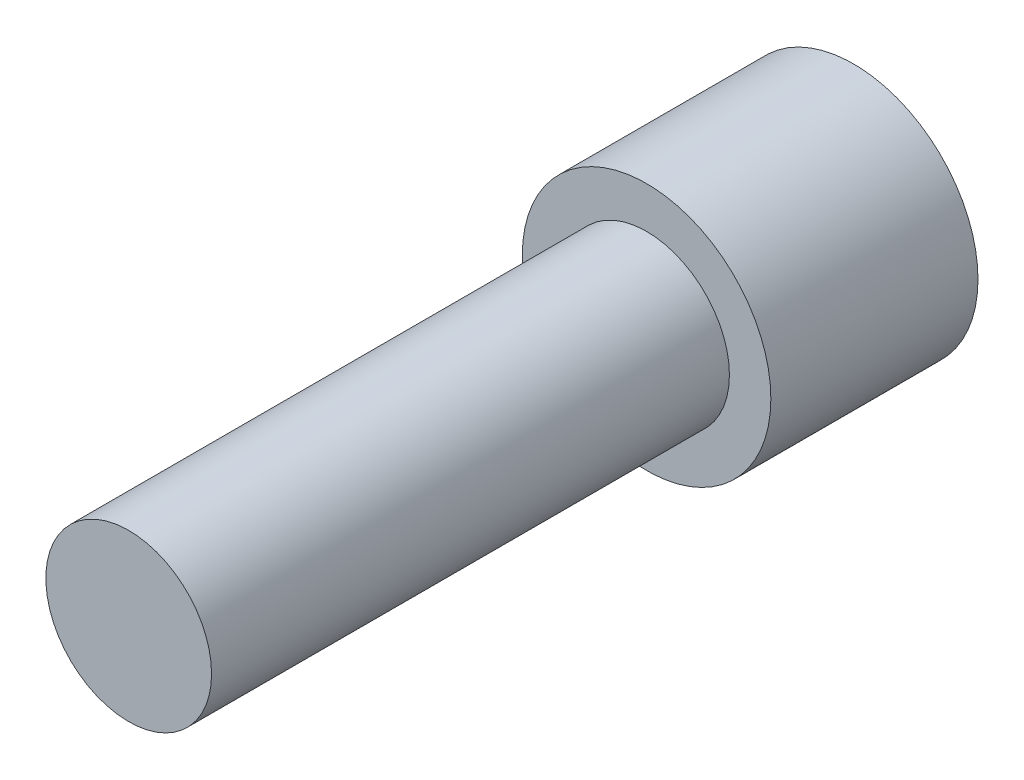
from build123d import *

# Parameters (mm, degrees)
SKETCH1_R           = 6
BOSS_EXTRUDE1_DEPTH = 10
SKETCH3_R           = 4
BOSS_EXTRUDE2_DEPTH = 25
CUT_EXTRUDE1_DEPTH  = 7


with BuildPart() as part:
    # Sketch1 → Boss-Extrude1 (new body)
    with BuildSketch(Plane.XY):
        Circle(SKETCH1_R)
    extrude(amount=BOSS_EXTRUDE1_DEPTH)

    # Sketch3 → Boss-Extrude2 (add)
    with BuildSketch(Plane.XY.offset(10)):
        Circle(SKETCH3_R)
    extrude(amount=BOSS_EXTRUDE2_DEPTH)

    # Sketch2 → Cut-Extrude1 (cut)
    with BuildSketch(Plane(origin=(0, 0, 0), x_dir=(-1, 0, 0), z_dir=(0, 0, -1))):
        Polygon((2.309401077, 4), (-2.309401077, 4), (-4.618802154, 0), (-2.309401077, -4), (2.309401077, -4), (4.618802154, 0), align=None)
    extrude(amount=-CUT_EXTRUDE1_DEPTH, mode=Mode.SUBTRACT)


solid = part.part
